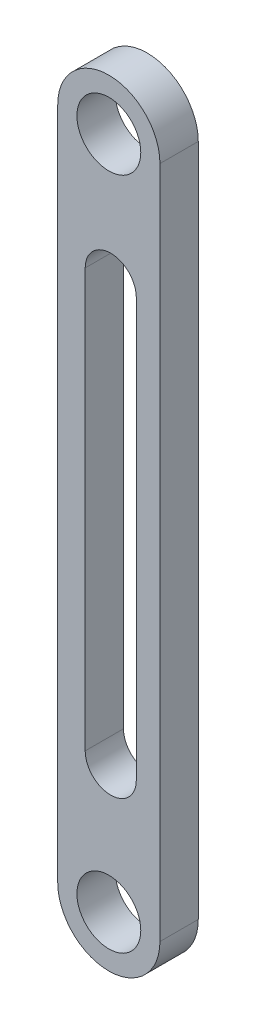
from build123d import *

# Parameters (mm, degrees)
BOSS_EXTRUDE1_DEPTH = 3
CUT_EXTRUDE1_REACH  = 42.606
SKETCH2_R           = 2.5
CUT_EXTRUDE2_REACH  = 42.606


with BuildPart() as part:
    # Sketch1 → Boss-Extrude1 (new body)
    with BuildSketch(Plane(origin=(0, 0, 0), x_dir=(0, 1, 0), z_dir=(0, 0, 1))):
        with BuildLine():
            Line((-16.529411765, 4.794117647), (36.210588235, 4.794117647))
            ThreePointArc((36.210588235, 4.794117647), (40.210588235, 0.794117647), (36.210588235, -3.205882353))
            Line((36.210588235, -3.205882353), (-16.529411765, -3.205882353))
            ThreePointArc((-16.529411765, -3.205882353), (-20.529411765, 0.794117647), (-16.529411765, 4.794117647))
        make_face()
    extrude(amount=BOSS_EXTRUDE1_DEPTH)

    # Sketch2 → Cut-Extrude1 (cut, up to next)
    with BuildSketch(Plane.XY.offset(3), mode=Mode.PRIVATE) as cut_extrude1_sk1:
        with Locations((-0.794117647, -16.529411765)):
            Circle(SKETCH2_R)
    cut_extrude1_tool1 = extrude(cut_extrude1_sk1.sketch, amount=-CUT_EXTRUDE1_REACH, mode=Mode.PRIVATE) & part.part
    # Sketch2 → Cut-Extrude1 (cut, up to next)
    with BuildSketch(Plane.XY.offset(3), mode=Mode.PRIVATE) as cut_extrude1_sk2:
        with Locations((-0.794117647, 36.210588235)):
            Circle(SKETCH2_R)
    cut_extrude1_tool2 = extrude(cut_extrude1_sk2.sketch, amount=-CUT_EXTRUDE1_REACH, mode=Mode.PRIVATE) & part.part
    add(cut_extrude1_tool1.solids().sort_by_distance((-0.794118, -16.529412, 3))[0], mode=Mode.SUBTRACT)
    add(cut_extrude1_tool2.solids().sort_by_distance((-0.794118, 36.210588, 3))[0], mode=Mode.SUBTRACT)

    # Sketch3 → Cut-Extrude2 (cut, up to next)
    with BuildSketch(Plane.XY.offset(3), mode=Mode.PRIVATE) as cut_extrude2_sk1:
        with BuildLine():
            Line((-2.645474442, -6.529411765), (-2.645474442, 26.210588235))
            ThreePointArc((-2.645474442, 26.210588235), (-0.645474442, 28.210588235), (1.354525558, 26.210588235))
            Line((1.354525558, 26.210588235), (1.354525558, -6.529411765))
            ThreePointArc((1.354525558, -6.529411765), (-0.645474442, -8.529411765), (-2.645474442, -6.529411765))
        make_face()
    cut_extrude2_tool1 = extrude(cut_extrude2_sk1.sketch, amount=-CUT_EXTRUDE2_REACH, mode=Mode.PRIVATE) & part.part
    add(cut_extrude2_tool1.solids().sort_by_distance((-0.645474, 9.840588, 3))[0], mode=Mode.SUBTRACT)


solid = part.part
